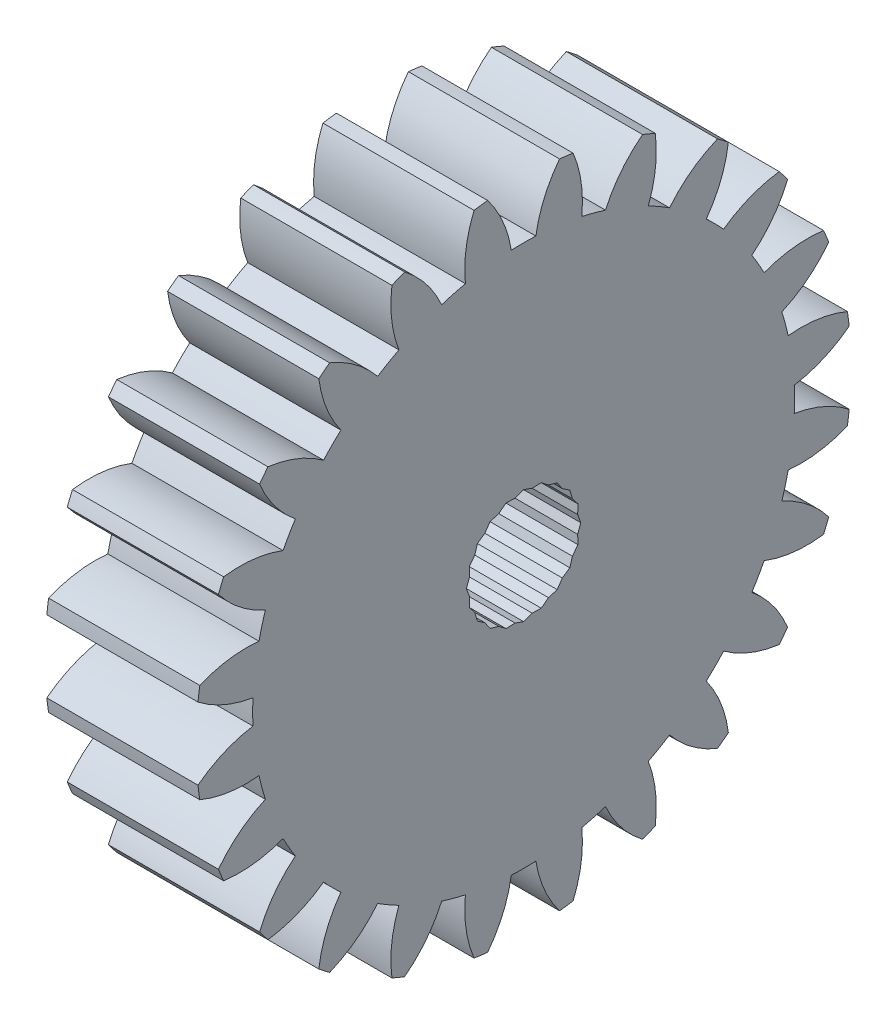
from build123d import *

# Parameters (mm, degrees)
SKETCH1_W          = 6.35
SKETCH1_H          = 13.758333333
CUT_EXTRUDE1_DEPTH = 21.467192583
CUT_EXTRUDE2_DEPTH = 21.355440594


with BuildPart() as part:
    # Sketch1 → Revolve1 (revolve)
    with BuildSketch(Plane.XY, mode=Mode.PRIVATE) as revolve1_sk:
        with Locations((3.175, 6.879166667)):
            Rectangle(SKETCH1_W, SKETCH1_H)
    revolve(revolve1_sk.sketch.rotate(Axis((-10, 0, 0), (1, 0, 0)), 90), axis=Axis((-10, 0, 0), (1, 0, 0)))

    # Sketch2 → Cut-Extrude1 (cut, through all)
    with BuildSketch(Plane.ZY):
        with BuildLine():
            ThreePointArc((0.515999621, 11.367494756), (0, 11.3792), (-0.515999621, 11.367494756))
            ThreePointArc((-0.515999621, 11.367494756), (-0.87412462, 12.597453573), (-1.528549184, 13.698716801))
            ThreePointArc((-1.528549184, 13.698716801), (0, 13.783733333), (1.528549184, 13.698716801))
            ThreePointArc((1.528549184, 13.698716801), (0.87412462, 12.597453573), (0.515999621, 11.367494756))
        make_face()
        with BuildLine():
            ThreePointArc((2.443706778, 11.113707294), (2.416121359, 12.394445851), (2.069023668, 13.627561985))
            ThreePointArc((2.069023668, 13.627561985), (3.567492699, 13.314064009), (5.021953936, 12.836326705))
            ThreePointArc((5.021953936, 12.836326705), (4.10480045, 11.941965653), (3.440541498, 10.846606236))
            ThreePointArc((3.440541498, 10.846606236), (2.945153678, 10.991463163), (2.443706778, 11.113707294))
        make_face()
        with BuildLine():
            ThreePointArc((5.236878598, 10.102539047), (5.54171266, 11.346777128), (5.525595976, 12.627711341))
            ThreePointArc((5.525595976, 12.627711341), (6.891866667, 11.937063226), (8.173120825, 11.099162157))
            ThreePointArc((8.173120825, 11.099162157), (7.055740914, 10.472652508), (6.130616158, 9.586539426))
            ThreePointArc((6.130616158, 9.586539426), (5.6896, 9.854676275), (5.236878598, 10.102539047))
        make_face()
        with BuildLine():
            ThreePointArc((7.673165796, 8.402899458), (8.289645401, 9.525844294), (8.60560805, 10.767303037))
            ThreePointArc((8.60560805, 10.767303037), (9.74657131, 9.74657131), (10.767303037, 8.60560805))
            ThreePointArc((10.767303037, 8.60560805), (9.525844294, 8.289645401), (8.402899458, 7.673165796))
            ThreePointArc((8.402899458, 7.673165796), (8.046309484, 8.046309484), (7.673165796, 8.402899458))
        make_face()
        with BuildLine():
            ThreePointArc((9.586539426, 6.130616158), (10.472652508, 7.055740914), (11.099162157, 8.173120825))
            ThreePointArc((11.099162157, 8.173120825), (11.937063226, 6.891866667), (12.627711341, 5.525595976))
            ThreePointArc((12.627711341, 5.525595976), (11.346777128, 5.54171266), (10.102539047, 5.236878598))
            ThreePointArc((10.102539047, 5.236878598), (9.854676275, 5.6896), (9.586539426, 6.130616158))
        make_face()
        with BuildLine():
            ThreePointArc((10.846606236, 3.440541498), (11.941965653, 4.10480045), (12.836326705, 5.021953936))
            ThreePointArc((12.836326705, 5.021953936), (13.314064009, 3.567492699), (13.627561985, 2.069023668))
            ThreePointArc((13.627561985, 2.069023668), (12.394445851, 2.416121359), (11.113707294, 2.443706778))
            ThreePointArc((11.113707294, 2.443706778), (10.991463163, 2.945153678), (10.846606236, 3.440541498))
        make_face()
        with BuildLine():
            ThreePointArc((11.367494756, 0.515999621), (12.597453573, 0.87412462), (13.698716801, 1.528549184))
            ThreePointArc((13.698716801, 1.528549184), (13.783733333, 0), (13.698716801, -1.528549184))
            ThreePointArc((13.698716801, -1.528549184), (12.597453573, -0.87412462), (11.367494756, -0.515999621))
            ThreePointArc((11.367494756, -0.515999621), (11.3792, 0), (11.367494756, 0.515999621))
        make_face()
        with BuildLine():
            ThreePointArc((11.113707294, -2.443706778), (12.394445851, -2.416121359), (13.627561985, -2.069023668))
            ThreePointArc((13.627561985, -2.069023668), (13.314064009, -3.567492699), (12.836326705, -5.021953936))
            ThreePointArc((12.836326705, -5.021953936), (11.941965653, -4.10480045), (10.846606236, -3.440541498))
            ThreePointArc((10.846606236, -3.440541498), (10.991463163, -2.945153678), (11.113707294, -2.443706778))
        make_face()
        with BuildLine():
            ThreePointArc((10.102539047, -5.236878598), (11.346777128, -5.54171266), (12.627711341, -5.525595976))
            ThreePointArc((12.627711341, -5.525595976), (11.937063226, -6.891866667), (11.099162157, -8.173120825))
            ThreePointArc((11.099162157, -8.173120825), (10.472652508, -7.055740914), (9.586539426, -6.130616158))
            ThreePointArc((9.586539426, -6.130616158), (9.854676275, -5.6896), (10.102539047, -5.236878598))
        make_face()
        with BuildLine():
            ThreePointArc((8.402899458, -7.673165796), (9.525844294, -8.289645401), (10.767303037, -8.60560805))
            ThreePointArc((10.767303037, -8.60560805), (9.74657131, -9.74657131), (8.60560805, -10.767303037))
            ThreePointArc((8.60560805, -10.767303037), (8.289645401, -9.525844294), (7.673165796, -8.402899458))
            ThreePointArc((7.673165796, -8.402899458), (8.046309484, -8.046309484), (8.402899458, -7.673165796))
        make_face()
        with BuildLine():
            ThreePointArc((6.130616158, -9.586539426), (7.055740914, -10.472652508), (8.173120825, -11.099162157))
            ThreePointArc((8.173120825, -11.099162157), (6.891866667, -11.937063226), (5.525595976, -12.627711341))
            ThreePointArc((5.525595976, -12.627711341), (5.54171266, -11.346777128), (5.236878598, -10.102539047))
            ThreePointArc((5.236878598, -10.102539047), (5.6896, -9.854676275), (6.130616158, -9.586539426))
        make_face()
        with BuildLine():
            ThreePointArc((3.440541498, -10.846606236), (4.10480045, -11.941965653), (5.021953936, -12.836326705))
            ThreePointArc((5.021953936, -12.836326705), (3.567492699, -13.314064009), (2.069023668, -13.627561985))
            ThreePointArc((2.069023668, -13.627561985), (2.416121359, -12.394445851), (2.443706778, -11.113707294))
            ThreePointArc((2.443706778, -11.113707294), (2.945153678, -10.991463163), (3.440541498, -10.846606236))
        make_face()
        with BuildLine():
            ThreePointArc((0.515999621, -11.367494756), (0.87412462, -12.597453573), (1.528549184, -13.698716801))
            ThreePointArc((1.528549184, -13.698716801), (0, -13.783733333), (-1.528549184, -13.698716801))
            ThreePointArc((-1.528549184, -13.698716801), (-0.87412462, -12.597453573), (-0.515999621, -11.367494756))
            ThreePointArc((-0.515999621, -11.367494756), (0, -11.3792), (0.515999621, -11.367494756))
        make_face()
        with BuildLine():
            ThreePointArc((-2.443706778, -11.113707294), (-2.416121359, -12.394445851), (-2.069023668, -13.627561985))
            ThreePointArc((-2.069023668, -13.627561985), (-3.567492699, -13.314064009), (-5.021953936, -12.836326705))
            ThreePointArc((-5.021953936, -12.836326705), (-4.10480045, -11.941965653), (-3.440541498, -10.846606236))
            ThreePointArc((-3.440541498, -10.846606236), (-2.945153678, -10.991463163), (-2.443706778, -11.113707294))
        make_face()
        with BuildLine():
            ThreePointArc((-5.236878598, -10.102539047), (-5.54171266, -11.346777128), (-5.525595976, -12.627711341))
            ThreePointArc((-5.525595976, -12.627711341), (-6.891866667, -11.937063226), (-8.173120825, -11.099162157))
            ThreePointArc((-8.173120825, -11.099162157), (-7.055740914, -10.472652508), (-6.130616158, -9.586539426))
            ThreePointArc((-6.130616158, -9.586539426), (-5.6896, -9.854676275), (-5.236878598, -10.102539047))
        make_face()
        with BuildLine():
            ThreePointArc((-7.673165796, -8.402899458), (-8.289645401, -9.525844294), (-8.60560805, -10.767303037))
            ThreePointArc((-8.60560805, -10.767303037), (-9.74657131, -9.74657131), (-10.767303037, -8.60560805))
            ThreePointArc((-10.767303037, -8.60560805), (-9.525844294, -8.289645401), (-8.402899458, -7.673165796))
            ThreePointArc((-8.402899458, -7.673165796), (-8.046309484, -8.046309484), (-7.673165796, -8.402899458))
        make_face()
        with BuildLine():
            ThreePointArc((-9.586539426, -6.130616158), (-10.472652508, -7.055740914), (-11.099162157, -8.173120825))
            ThreePointArc((-11.099162157, -8.173120825), (-11.937063226, -6.891866667), (-12.627711341, -5.525595976))
            ThreePointArc((-12.627711341, -5.525595976), (-11.346777128, -5.54171266), (-10.102539047, -5.236878598))
            ThreePointArc((-10.102539047, -5.236878598), (-9.854676275, -5.6896), (-9.586539426, -6.130616158))
        make_face()
        with BuildLine():
            ThreePointArc((-10.846606236, -3.440541498), (-11.941965653, -4.10480045), (-12.836326705, -5.021953936))
            ThreePointArc((-12.836326705, -5.021953936), (-13.314064009, -3.567492699), (-13.627561985, -2.069023668))
            ThreePointArc((-13.627561985, -2.069023668), (-12.394445851, -2.416121359), (-11.113707294, -2.443706778))
            ThreePointArc((-11.113707294, -2.443706778), (-10.991463163, -2.945153678), (-10.846606236, -3.440541498))
        make_face()
        with BuildLine():
            ThreePointArc((-11.367494756, -0.515999621), (-12.597453573, -0.87412462), (-13.698716801, -1.528549184))
            ThreePointArc((-13.698716801, -1.528549184), (-13.783733333, 0), (-13.698716801, 1.528549184))
            ThreePointArc((-13.698716801, 1.528549184), (-12.597453573, 0.87412462), (-11.367494756, 0.515999621))
            ThreePointArc((-11.367494756, 0.515999621), (-11.3792, 0), (-11.367494756, -0.515999621))
        make_face()
        with BuildLine():
            ThreePointArc((-11.113707294, 2.443706778), (-12.394445851, 2.416121359), (-13.627561985, 2.069023668))
            ThreePointArc((-13.627561985, 2.069023668), (-13.314064009, 3.567492699), (-12.836326705, 5.021953936))
            ThreePointArc((-12.836326705, 5.021953936), (-11.941965653, 4.10480045), (-10.846606236, 3.440541498))
            ThreePointArc((-10.846606236, 3.440541498), (-10.991463163, 2.945153678), (-11.113707294, 2.443706778))
        make_face()
        with BuildLine():
            ThreePointArc((-10.102539047, 5.236878598), (-11.346777128, 5.54171266), (-12.627711341, 5.525595976))
            ThreePointArc((-12.627711341, 5.525595976), (-11.937063226, 6.891866667), (-11.099162157, 8.173120825))
            ThreePointArc((-11.099162157, 8.173120825), (-10.472652508, 7.055740914), (-9.586539426, 6.130616158))
            ThreePointArc((-9.586539426, 6.130616158), (-9.854676275, 5.6896), (-10.102539047, 5.236878598))
        make_face()
        with BuildLine():
            ThreePointArc((-8.402899458, 7.673165796), (-9.525844294, 8.289645401), (-10.767303037, 8.60560805))
            ThreePointArc((-10.767303037, 8.60560805), (-9.74657131, 9.74657131), (-8.60560805, 10.767303037))
            ThreePointArc((-8.60560805, 10.767303037), (-8.289645401, 9.525844294), (-7.673165796, 8.402899458))
            ThreePointArc((-7.673165796, 8.402899458), (-8.046309484, 8.046309484), (-8.402899458, 7.673165796))
        make_face()
        with BuildLine():
            ThreePointArc((-6.130616158, 9.586539426), (-7.055740914, 10.472652508), (-8.173120825, 11.099162157))
            ThreePointArc((-8.173120825, 11.099162157), (-6.891866667, 11.937063226), (-5.525595976, 12.627711341))
            ThreePointArc((-5.525595976, 12.627711341), (-5.54171266, 11.346777128), (-5.236878598, 10.102539047))
            ThreePointArc((-5.236878598, 10.102539047), (-5.6896, 9.854676275), (-6.130616158, 9.586539426))
        make_face()
        with BuildLine():
            ThreePointArc((-3.440541498, 10.846606236), (-4.10480045, 11.941965653), (-5.021953936, 12.836326705))
            ThreePointArc((-5.021953936, 12.836326705), (-3.567492699, 13.314064009), (-2.069023668, 13.627561985))
            ThreePointArc((-2.069023668, 13.627561985), (-2.416121359, 12.394445851), (-2.443706778, 11.113707294))
            ThreePointArc((-2.443706778, 11.113707294), (-2.945153678, 10.991463163), (-3.440541498, 10.846606236))
        make_face()
    extrude(amount=-CUT_EXTRUDE1_DEPTH, mode=Mode.SUBTRACT)

    # Sketch3 → Cut-Extrude2 (cut, through all)
    with BuildSketch(Plane.ZY):
        Polygon((-0.35979927, 2.271683183), (0, 2.4), (0.35979927, 2.271683183), (0.741640786, 2.282535639), (1.044178149, 2.049315006), (1.410684606, 1.941640786), (1.626345597, 1.626345597), (1.941640786, 1.410684606), (2.049315006, 1.044178149), (2.282535639, 0.741640786), (2.271683183, 0.35979927), (2.4, 0), (2.271683183, -0.35979927), (2.282535639, -0.741640786), (2.049315006, -1.044178149), (1.941640786, -1.410684606), (1.626345597, -1.626345597), (1.410684606, -1.941640786), (1.044178149, -2.049315006), (0.741640786, -2.282535639), (0.35979927, -2.271683183), (0, -2.4), (-0.35979927, -2.271683183), (-0.741640786, -2.282535639), (-1.044178149, -2.049315006), (-1.410684606, -1.941640786), (-1.626345597, -1.626345597), (-1.941640786, -1.410684606), (-2.049315006, -1.044178149), (-2.282535639, -0.741640786), (-2.271683183, -0.35979927), (-2.4, 0), (-2.271683183, 0.35979927), (-2.282535639, 0.741640786), (-2.049315006, 1.044178149), (-1.941640786, 1.410684606), (-1.626345597, 1.626345597), (-1.410684606, 1.941640786), (-1.044178149, 2.049315006), (-0.741640786, 2.282535639), align=None)
    extrude(amount=-CUT_EXTRUDE2_DEPTH, mode=Mode.SUBTRACT)


solid = part.part
